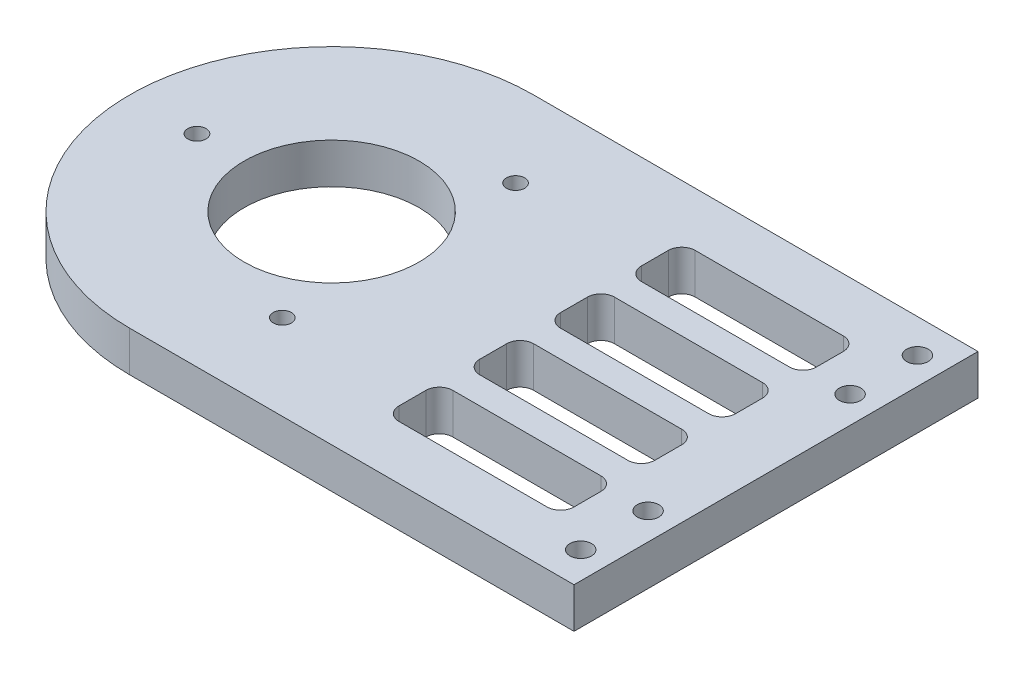
from build123d import *

# Parameters (mm, degrees)
EXTRUDE_1_DEPTH     = 6
SKETCH_2_R          = 13
SKETCH_2_R_2        = 1.35
CUT_EXTRUDE_1_DEPTH = 6
CUT_EXTRUDE_2_DEPTH = 6
SKETCH_4_R          = 1.6
CUT_EXTRUDE_3_DEPTH = 6


with BuildPart() as part:
    # 草图1 → 凸台-拉伸1 (new body)
    with BuildSketch(Plane(origin=(0, 0, 0), x_dir=(1, 0, 0), z_dir=(0, 1, 0))):
        with BuildLine():
            Line((-33, -30), (33, -30))
            Line((33, -30), (33, 30))
            Line((33, 30), (-33, 30))
            ThreePointArc((-33, 30), (-63, 0), (-33, -30))
        make_face()
    extrude(amount=EXTRUDE_1_DEPTH)

    # 草图2 → 切除-拉伸1 (cut)
    with BuildSketch(Plane(origin=(0, 6, 0), x_dir=(1, 0, 0), z_dir=(0, 1, 0))):
        with Locations(Location((-33, 0, 0), (0, 0, 270))):
            Circle(SKETCH_2_R)
        with Locations(Location((-53, 0, 0), (0, 0, 270))):
            Circle(SKETCH_2_R_2)
        with Locations(Location((-23, 17.320508076, 0), (0, 0, 270))):
            Circle(SKETCH_2_R_2)
        with Locations(Location((-23, -17.320508076, 0), (0, 0, 270))):
            Circle(SKETCH_2_R_2)
    extrude(amount=-CUT_EXTRUDE_1_DEPTH, mode=Mode.SUBTRACT)

    # 草图3 → 切除-拉伸2 (cut)
    with BuildSketch(Plane(origin=(0, 6, 0), x_dir=(1, 0, 0), z_dir=(0, 1, 0))):
        with BuildLine():
            Line((21, 14), (-1, 14))
            ThreePointArc((-1, 14), (-2.414213562, 14.585786438), (-3, 16))
            Line((-3, 16), (-3, 20))
            ThreePointArc((-3, 20), (-2.414213562, 21.414213562), (-1, 22))
            Line((-1, 22), (21, 22))
            ThreePointArc((21, 22), (22.414213562, 21.414213562), (23, 20))
            Line((23, 20), (23, 16))
            ThreePointArc((23, 16), (22.414213562, 14.585786438), (21, 14))
        make_face()
        with BuildLine():
            Line((23, 4), (23, 8))
            ThreePointArc((23, 8), (22.414213562, 9.414213562), (21, 10))
            Line((21, 10), (-1, 10))
            ThreePointArc((-1, 10), (-2.414213562, 9.414213562), (-3, 8))
            Line((-3, 8), (-3, 4))
            ThreePointArc((-3, 4), (-2.414213562, 2.585786438), (-1, 2))
            Line((-1, 2), (21, 2))
            ThreePointArc((21, 2), (22.414213562, 2.585786438), (23, 4))
        make_face()
        with BuildLine():
            Line((23, -8), (23, -4))
            ThreePointArc((23, -4), (22.414213562, -2.585786438), (21, -2))
            Line((21, -2), (-1, -2))
            ThreePointArc((-1, -2), (-2.414213562, -2.585786438), (-3, -4))
            Line((-3, -4), (-3, -8))
            ThreePointArc((-3, -8), (-2.414213562, -9.414213562), (-1, -10))
            Line((-1, -10), (21, -10))
            ThreePointArc((21, -10), (22.414213562, -9.414213562), (23, -8))
        make_face()
        with BuildLine():
            Line((23, -20), (23, -16))
            ThreePointArc((23, -16), (22.414213562, -14.585786438), (21, -14))
            Line((21, -14), (-1, -14))
            ThreePointArc((-1, -14), (-2.414213562, -14.585786438), (-3, -16))
            Line((-3, -16), (-3, -20))
            ThreePointArc((-3, -20), (-2.414213562, -21.414213562), (-1, -22))
            Line((-1, -22), (21, -22))
            ThreePointArc((21, -22), (22.414213562, -21.414213562), (23, -20))
        make_face()
    extrude(amount=-CUT_EXTRUDE_2_DEPTH, mode=Mode.SUBTRACT)

    # 草图4 → 切除-拉伸3 (cut)
    with BuildSketch(Plane(origin=(0, 6, 0), x_dir=(1, 0, 0), z_dir=(0, 1, 0))):
        with Locations(Location((29, 25, 0), (0, 0, 270))):
            Circle(SKETCH_4_R)
        with Locations(Location((29, 15, 0), (0, 0, 270))):
            Circle(SKETCH_4_R)
        with Locations(Location((29, -25, 0), (0, 0, 270))):
            Circle(SKETCH_4_R)
        with Locations(Location((29, -15, 0), (0, 0, 270))):
            Circle(SKETCH_4_R)
    extrude(amount=-CUT_EXTRUDE_3_DEPTH, mode=Mode.SUBTRACT)


solid = part.part
